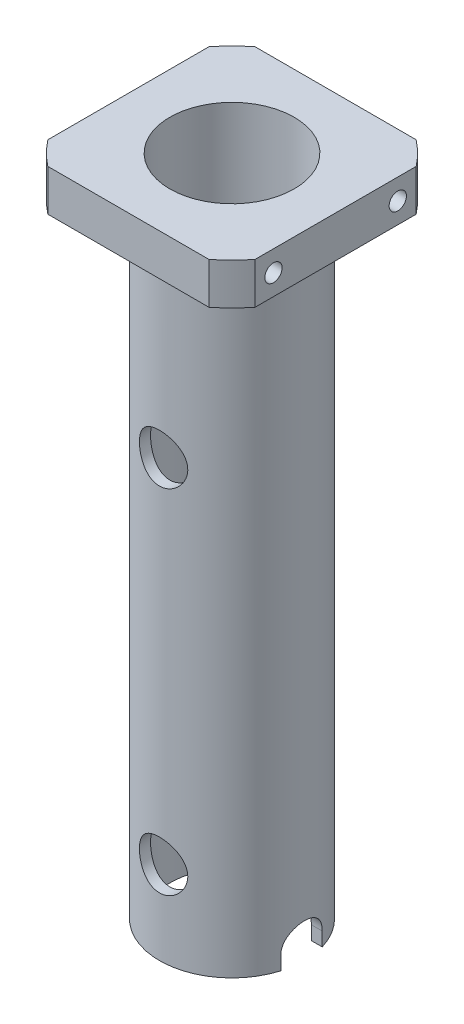
from build123d import *

# Parameters (mm, degrees)
SKETCH_1_R               = 10.5
SKETCH_1_R_2             = 9
EXTRUDE_1_DEPTH          = 90
CUT_EXTRUDE_1_REACH      = 95.012
CUT_EXTRUDE_1_END_RADIUS = 9
SKETCH_4_R               = 3.5
CUT_EXTRUDE_2_DEPTH      = 94.012096118
SKETCH_5_R               = 9
EXTRUDE_2_DEPTH          = 6
HOLE_WIZARD_M3_1_D       = 2.5
HOLE_WIZARD_M3_1_DEPTH   = 8
HOLE_WIZARD_M3_1_TIP     = 0.751075774
HOLE_WIZARD_M3_2_D       = 2.5
HOLE_WIZARD_M3_2_DEPTH   = 8
HOLE_WIZARD_M3_2_TIP     = 0.751075774


with BuildPart() as part:
    # 草图1 → 凸台-拉伸1 (new body)
    with BuildSketch(Plane(origin=(0, 0, 0), x_dir=(1, 0, 0), z_dir=(0, 1, 0))):
        with Locations(Location((0, 0, 0), (0, 0, 90))):
            Circle(SKETCH_1_R)
        with Locations(Location((0, 0, 0), (0, 0, 90))):
            Circle(SKETCH_1_R_2, mode=Mode.SUBTRACT)
    extrude(amount=EXTRUDE_1_DEPTH)

    # 切除-拉伸1: up to this cylinder (the profile starts outside it)
    cut_extrude_1_end = Plane(origin=(0, 2.229558, 0), z_dir=(0, -1, 0)) * Cylinder(CUT_EXTRUDE_1_END_RADIUS, 209.024, mode=Mode.PRIVATE)
    # 草图3 → 切除-拉伸1 (cut, up to the surface)
    with BuildSketch(Plane(origin=(10.5, 0, 0), x_dir=(0, 0, -1), z_dir=(1, 0, 0)), mode=Mode.PRIVATE) as cut_extrude_1_sk1:
        with BuildLine():
            Line((-3, 0), (-3, 2))
            ThreePointArc((-3, 2), (0, 5), (3, 2))
            Line((3, 2), (3, 0))
            Line((3, 0), (-3, 0))
        make_face()
    cut_extrude_1_tool1 = extrude(cut_extrude_1_sk1.sketch, amount=-CUT_EXTRUDE_1_REACH, mode=Mode.PRIVATE) - cut_extrude_1_end
    add(cut_extrude_1_tool1.solids().sort_by_distance((10.5, 2.229558, 0))[0], mode=Mode.SUBTRACT)

    # 草图4 → 切除-拉伸2 (cut, through all)
    with BuildSketch(Plane(origin=(0, 0, -10.5), x_dir=(-1, 0, 0), z_dir=(0, 0, -1))):
        with Locations((0, 63)):
            Circle(SKETCH_4_R)
        with Locations((0, 12)):
            Circle(SKETCH_4_R)
    extrude(amount=-CUT_EXTRUDE_2_DEPTH, mode=Mode.SUBTRACT)

    # 草图5 → 凸台-拉伸2 (add)
    with BuildSketch(Plane(origin=(0, 90, 0), x_dir=(1, 0, 0), z_dir=(0, 1, 0))):
        with BuildLine():
            Line((11.66190379, 15), (-11.66190379, 15))
            ThreePointArc((-11.66190379, 15), (-13.435028843, 13.435028843), (-15, 11.66190379))
            Line((-15, 11.66190379), (-15, -11.66190379))
            ThreePointArc((-15, -11.66190379), (-13.435028843, -13.435028843), (-11.66190379, -15))
            Line((-11.66190379, -15), (11.66190379, -15))
            ThreePointArc((11.66190379, -15), (13.435028843, -13.435028843), (15, -11.66190379))
            Line((15, -11.66190379), (15, 11.66190379))
            ThreePointArc((15, 11.66190379), (13.435028843, 13.435028843), (11.66190379, 15))
        make_face()
        with Locations(Location((0, 0, 0), (0, 0, 19.471220634))):
            Circle(SKETCH_5_R, mode=Mode.SUBTRACT)
    extrude(amount=EXTRUDE_2_DEPTH)

    # M3 螺纹孔1
    with Locations(Plane(origin=(15, 0, 0), x_dir=(0, 0, -1), z_dir=(1, 0, 0))):
        with Locations((-9, 93), (9, 93)):
            Hole(HOLE_WIZARD_M3_1_D / 2, depth=HOLE_WIZARD_M3_1_DEPTH)
            with Locations((0, 0, -(HOLE_WIZARD_M3_1_DEPTH + HOLE_WIZARD_M3_1_TIP / 2))):  # 118° drill point
                Cone(0, HOLE_WIZARD_M3_1_D / 2, HOLE_WIZARD_M3_1_TIP, mode=Mode.SUBTRACT)

    # M3 螺纹孔2
    with Locations(Plane.ZY.offset(15)):
        with Locations((-9, 93), (9, 93)):
            Hole(HOLE_WIZARD_M3_2_D / 2, depth=HOLE_WIZARD_M3_2_DEPTH)
            with Locations((0, 0, -(HOLE_WIZARD_M3_2_DEPTH + HOLE_WIZARD_M3_2_TIP / 2))):  # 118° drill point
                Cone(0, HOLE_WIZARD_M3_2_D / 2, HOLE_WIZARD_M3_2_TIP, mode=Mode.SUBTRACT)


solid = part.part
